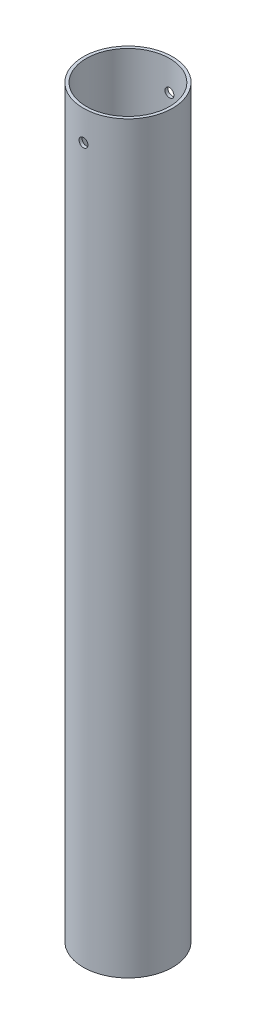
from build123d import *

# Parameters (mm, degrees)
SKETCH1_R               = 15
SKETCH1_R_2             = 14
BOSS_EXTRUDE1_DEPTH     = 250
CUT_EXTRUDE1_DEPTH      = 253.239965113
CUT_EXTRUDE1_DEPTH_BACK = 253.239965113
SKETCH2_R               = 1.5


with BuildPart() as part:
    # Sketch1 → Boss-Extrude1 (new body)
    with BuildSketch(Plane(origin=(0, 0, 0), x_dir=(1, 0, 0), z_dir=(0, 1, 0))):
        with Locations(Location((0, 0, 0), (0, 0, 270))):
            Circle(SKETCH1_R)
        with Locations(Location((0, 0, 0), (0, 0, 270))):
            Circle(SKETCH1_R_2, mode=Mode.SUBTRACT)
    extrude(amount=BOSS_EXTRUDE1_DEPTH)

    # Sketch2 → Cut-Extrude1 (cut, two sides: drawn at the far end of the back side and taken through both)
    with BuildSketch(Plane.XY.offset(15).offset(-CUT_EXTRUDE1_DEPTH_BACK)):
        with Locations((0, 240)):
            Circle(SKETCH2_R)
    extrude(amount=CUT_EXTRUDE1_DEPTH + CUT_EXTRUDE1_DEPTH_BACK, mode=Mode.SUBTRACT)


solid = part.part
